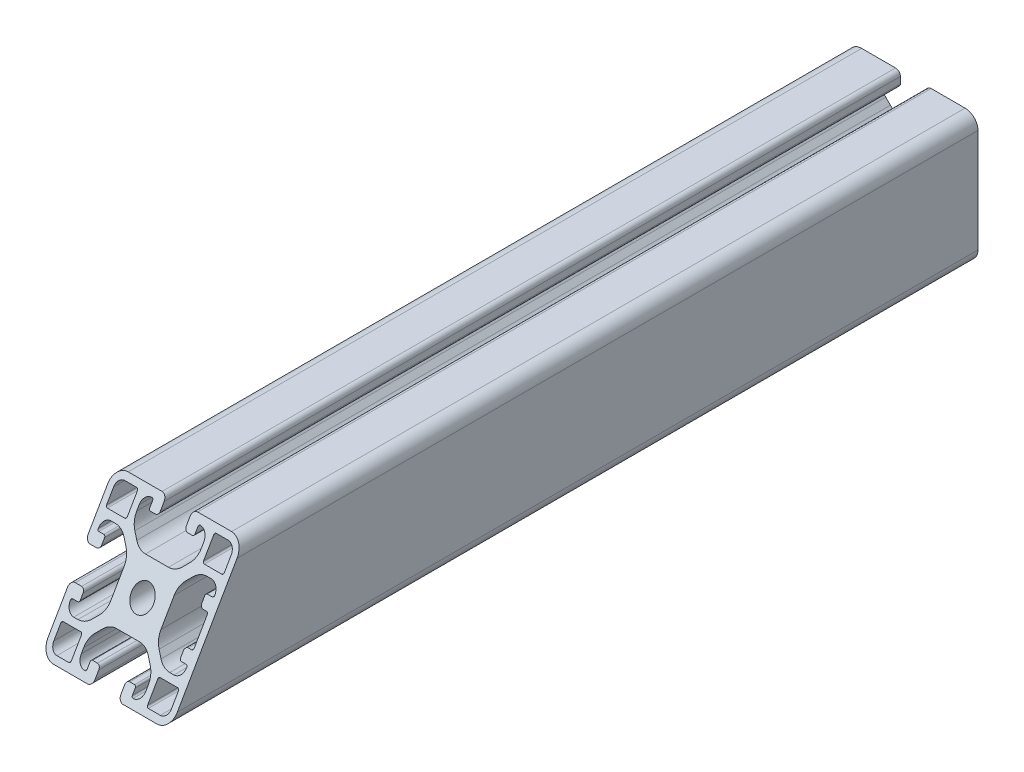
from build123d import *

# Parameters (mm, degrees)
SCHIZZO1_R                   = 3.4
ESTRUSIONE_ESTRUSIONE1_DEPTH = 250
TAGLIO_ESTRUSIONE4_DEPTH     = 343.92856399


with BuildPart() as part:
    # Schizzo1 → Estrusione-Estrusione1 (new body)
    with BuildSketch(Plane(origin=(0, 0, -340), x_dir=(-1, 0, 0), z_dir=(0, 0, -1))):
        with BuildLine():
            Line((6.5, -15.5), (5, -15.5))
            ThreePointArc((5, -15.5), (4.292893219, -15.792893219), (4, -16.5))
            Line((4, -16.5), (4, -18.5))
            ThreePointArc((4, -18.5), (4.439339828, -19.560660172), (5.5, -20))
            Line((5.5, -20), (16, -20))
            ThreePointArc((16, -20), (18.828427125, -18.828427125), (20, -16))
            Line((20, -16), (20, -5.5))
            ThreePointArc((20, -5.5), (19.560660172, -4.439339828), (18.5, -4))
            Line((18.5, -4), (16.5, -4))
            ThreePointArc((16.5, -4), (15.792893219, -4.292893219), (15.5, -5))
            Line((15.5, -5), (15.5, -6.5))
            ThreePointArc((15.5, -6.5), (15.646446609, -6.853553391), (16, -7))
            Line((16, -7), (17.55, -7))
            ThreePointArc((17.55, -7), (17.868198052, -7.131801948), (18, -7.45))
            Line((18, -7.45), (18, -7.5))
            ThreePointArc((18, -7.5), (17.267766953, -9.267766953), (15.5, -10))
            Line((15.5, -10), (14.192388155, -10))
            ThreePointArc((14.192388155, -10), (12.278970994, -9.619397663), (10.656854249, -8.535533906))
            Line((10.656854249, -8.535533906), (9.214466094, -7.09314575))
            ThreePointArc((9.214466094, -7.09314575), (8.130602337, -5.471029006), (7.75, -3.557611845))
            Line((7.75, -3.557611845), (7.75, 3.557611845))
            ThreePointArc((7.75, 3.557611845), (8.130602337, 5.471029006), (9.214466094, 7.09314575))
            Line((9.214466094, 7.09314575), (10.656854249, 8.535533906))
            ThreePointArc((10.656854249, 8.535533906), (12.278970994, 9.619397663), (14.192388155, 10))
            Line((14.192388155, 10), (15.5, 10))
            ThreePointArc((15.5, 10), (17.267766953, 9.267766953), (18, 7.5))
            Line((18, 7.5), (18, 7.45))
            ThreePointArc((18, 7.45), (17.868198052, 7.131801948), (17.55, 7))
            Line((17.55, 7), (16, 7))
            ThreePointArc((16, 7), (15.646446609, 6.853553391), (15.5, 6.5))
            Line((15.5, 6.5), (15.5, 5))
            ThreePointArc((15.5, 5), (15.792893219, 4.292893219), (16.5, 4))
            Line((16.5, 4), (18.5, 4))
            ThreePointArc((18.5, 4), (19.560660172, 4.439339828), (20, 5.5))
            Line((20, 5.5), (20, 16))
            ThreePointArc((20, 16), (18.828427125, 18.828427125), (16, 20))
            Line((16, 20), (5.5, 20))
            ThreePointArc((5.5, 20), (4.439339828, 19.560660172), (4, 18.5))
            Line((4, 18.5), (4, 16.5))
            ThreePointArc((4, 16.5), (4.292893219, 15.792893219), (5, 15.5))
            Line((5, 15.5), (6.5, 15.5))
            ThreePointArc((6.5, 15.5), (6.853553391, 15.646446609), (7, 16))
            Line((7, 16), (7, 17.55))
            ThreePointArc((7, 17.55), (7.131801948, 17.868198052), (7.45, 18))
            Line((7.45, 18), (7.5, 18))
            ThreePointArc((7.5, 18), (9.267766953, 17.267766953), (10, 15.5))
            Line((10, 15.5), (10, 14.192388155))
            ThreePointArc((10, 14.192388155), (9.619397663, 12.278970994), (8.535533906, 10.656854249))
            Line((8.535533906, 10.656854249), (7.09314575, 9.214466094))
            ThreePointArc((7.09314575, 9.214466094), (5.471029006, 8.130602337), (3.557611844, 7.75))
            Line((3.557611844, 7.75), (-3.557611845, 7.75))
            ThreePointArc((-3.557611845, 7.75), (-5.471029006, 8.130602337), (-7.09314575, 9.214466094))
            Line((-7.09314575, 9.214466094), (-8.535533906, 10.656854249))
            ThreePointArc((-8.535533906, 10.656854249), (-9.619397663, 12.278970994), (-10, 14.192388155))
            Line((-10, 14.192388155), (-10, 15.5))
            ThreePointArc((-10, 15.5), (-9.267766953, 17.267766953), (-7.5, 18))
            Line((-7.5, 18), (-7.45, 18))
            ThreePointArc((-7.45, 18), (-7.131801948, 17.868198052), (-7, 17.55))
            Line((-7, 17.55), (-7, 16))
            ThreePointArc((-7, 16), (-6.853553391, 15.646446609), (-6.5, 15.5))
            Line((-6.5, 15.5), (-5, 15.5))
            ThreePointArc((-5, 15.5), (-4.292893219, 15.792893219), (-4, 16.5))
            Line((-4, 16.5), (-4, 18.5))
            ThreePointArc((-4, 18.5), (-4.439339828, 19.560660172), (-5.5, 20))
            Line((-5.5, 20), (-16, 20))
            ThreePointArc((-16, 20), (-18.828427125, 18.828427125), (-20, 16))
            Line((-20, 16), (-20, -16))
            ThreePointArc((-20, -16), (-18.828427125, -18.828427125), (-16, -20))
            Line((-16, -20), (-5.5, -20))
            ThreePointArc((-5.5, -20), (-4.439339828, -19.560660172), (-4, -18.5))
            Line((-4, -18.5), (-4, -16.5))
            ThreePointArc((-4, -16.5), (-4.292893219, -15.792893219), (-5, -15.5))
            Line((-5, -15.5), (-6.5, -15.5))
            ThreePointArc((-6.5, -15.5), (-6.853553391, -15.646446609), (-7, -16))
            Line((-7, -16), (-7, -17.55))
            ThreePointArc((-7, -17.55), (-7.131801948, -17.868198052), (-7.45, -18))
            Line((-7.45, -18), (-7.5, -18))
            ThreePointArc((-7.5, -18), (-9.267766953, -17.267766953), (-10, -15.5))
            Line((-10, -15.5), (-10, -14.192388155))
            ThreePointArc((-10, -14.192388155), (-9.619397663, -12.278970994), (-8.535533906, -10.656854249))
            Line((-8.535533906, -10.656854249), (-7.09314575, -9.214466094))
            ThreePointArc((-7.09314575, -9.214466094), (-5.471029006, -8.130602337), (-3.557611845, -7.75))
            Line((-3.557611845, -7.75), (3.557611845, -7.75))
            ThreePointArc((3.557611845, -7.75), (5.471029006, -8.130602337), (7.09314575, -9.214466094))
            Line((7.09314575, -9.214466094), (8.535533906, -10.656854249))
            ThreePointArc((8.535533906, -10.656854249), (9.619397663, -12.278970994), (10, -14.192388155))
            Line((10, -14.192388155), (10, -15.5))
            ThreePointArc((10, -15.5), (9.267766953, -17.267766953), (7.5, -18))
            Line((7.5, -18), (7.45, -18))
            ThreePointArc((7.45, -18), (7.131801948, -17.868198052), (7, -17.55))
            Line((7, -17.55), (7, -16))
            ThreePointArc((7, -16), (6.853553391, -15.646446609), (6.5, -15.5))
        make_face()
        with Locations(Location((0, 0, 0), (0, 0, 180))):
            Circle(SCHIZZO1_R, mode=Mode.SUBTRACT)
        with BuildLine():
            Line((-12.3, -18.2), (-16, -18.2))
            ThreePointArc((-16, -18.2), (-17.555634919, -17.555634919), (-18.2, -16))
            Line((-18.2, -16), (-18.2, -12.3))
            ThreePointArc((-18.2, -12.3), (-18.053553391, -11.946446609), (-17.7, -11.8))
            Line((-17.7, -11.8), (-12.3, -11.8))
            ThreePointArc((-12.3, -11.8), (-11.946446609, -11.946446609), (-11.8, -12.3))
            Line((-11.8, -12.3), (-11.8, -17.7))
            ThreePointArc((-11.8, -17.7), (-11.946446609, -18.053553391), (-12.3, -18.2))
        make_face(mode=Mode.SUBTRACT)
        with BuildLine():
            Line((-11.8, 17.7), (-11.8, 12.3))
            ThreePointArc((-11.8, 12.3), (-11.946446609, 11.946446609), (-12.3, 11.8))
            Line((-12.3, 11.8), (-17.7, 11.8))
            ThreePointArc((-17.7, 11.8), (-18.053553391, 11.946446609), (-18.2, 12.3))
            Line((-18.2, 12.3), (-18.2, 16))
            ThreePointArc((-18.2, 16), (-17.555634919, 17.555634919), (-16, 18.2))
            Line((-16, 18.2), (-12.3, 18.2))
            ThreePointArc((-12.3, 18.2), (-11.946446609, 18.053553391), (-11.8, 17.7))
        make_face(mode=Mode.SUBTRACT)
        with BuildLine():
            Line((18.2, 16), (18.2, 12.3))
            ThreePointArc((18.2, 12.3), (18.053553391, 11.946446609), (17.7, 11.8))
            Line((17.7, 11.8), (12.3, 11.8))
            ThreePointArc((12.3, 11.8), (11.946446609, 11.946446609), (11.8, 12.3))
            Line((11.8, 12.3), (11.8, 17.7))
            ThreePointArc((11.8, 17.7), (11.946446609, 18.053553391), (12.3, 18.2))
            Line((12.3, 18.2), (16, 18.2))
            ThreePointArc((16, 18.2), (17.555634919, 17.555634919), (18.2, 16))
        make_face(mode=Mode.SUBTRACT)
        with BuildLine():
            Line((18.2, -12.3), (18.2, -16))
            ThreePointArc((18.2, -16), (17.555634919, -17.555634919), (16, -18.2))
            Line((16, -18.2), (12.3, -18.2))
            ThreePointArc((12.3, -18.2), (11.946446609, -18.053553391), (11.8, -17.7))
            Line((11.8, -17.7), (11.8, -12.3))
            ThreePointArc((11.8, -12.3), (11.946446609, -11.946446609), (12.3, -11.8))
            Line((12.3, -11.8), (17.7, -11.8))
            ThreePointArc((17.7, -11.8), (18.053553391, -11.946446609), (18.2, -12.3))
        make_face(mode=Mode.SUBTRACT)
        with BuildLine():
            Line((-16, 7), (-17.5, 7))
            ThreePointArc((-17.5, 7), (-17.853553391, 7.146446609), (-18, 7.5))
            ThreePointArc((-18, 7.5), (-17.267766953, 9.267766953), (-15.5, 10))
            Line((-15.5, 10), (-14.192388155, 10))
            ThreePointArc((-14.192388155, 10), (-12.278970994, 9.619397663), (-10.656854249, 8.535533906))
            Line((-10.656854249, 8.535533906), (-9.214466094, 7.093145751))
            ThreePointArc((-9.214466094, 7.093145751), (-8.130602337, 5.471029006), (-7.75, 3.557611845))
            Line((-7.75, 3.557611845), (-7.75, -3.557611845))
            ThreePointArc((-7.75, -3.557611845), (-8.130602337, -5.471029006), (-9.214466094, -7.093145751))
            Line((-9.214466094, -7.093145751), (-10.656854249, -8.535533906))
            ThreePointArc((-10.656854249, -8.535533906), (-12.278970994, -9.619397663), (-14.192388155, -10))
            Line((-14.192388155, -10), (-15.5, -10))
            ThreePointArc((-15.5, -10), (-17.267766953, -9.267766953), (-18, -7.5))
            ThreePointArc((-18, -7.5), (-17.853553391, -7.146446609), (-17.5, -7))
            Line((-17.5, -7), (-16, -7))
            ThreePointArc((-16, -7), (-15.646446609, -6.853553391), (-15.5, -6.5))
            Line((-15.5, -6.5), (-15.5, -5))
            ThreePointArc((-15.5, -5), (-15.792893219, -4.292893219), (-16.5, -4))
            Line((-16.5, -4), (-17.5, -4))
            ThreePointArc((-17.5, -4), (-17.853553391, -3.853553391), (-18, -3.5))
            Line((-18, -3.5), (-18, 3.5))
            ThreePointArc((-18, 3.5), (-17.853553391, 3.853553391), (-17.5, 4))
            Line((-17.5, 4), (-16.5, 4))
            ThreePointArc((-16.5, 4), (-15.792893219, 4.292893219), (-15.5, 5))
            Line((-15.5, 5), (-15.5, 6.5))
            ThreePointArc((-15.5, 6.5), (-15.646446609, 6.853553391), (-16, 7))
        make_face(mode=Mode.SUBTRACT)
    extrude(amount=-ESTRUSIONE_ESTRUSIONE1_DEPTH)

    # Schizzo9 → Taglio-Estrusione4 (cut, through all)
    with BuildSketch(Plane(origin=(20, 0, 0), x_dir=(0, 0, -1), z_dir=(1, 0, 0))):
        Polygon((90, -20), (113.103770371, 20), (90, 20), (90, 16), (90, -16), align=None)
    extrude(amount=-TAGLIO_ESTRUSIONE4_DEPTH, mode=Mode.SUBTRACT)


solid = part.part
